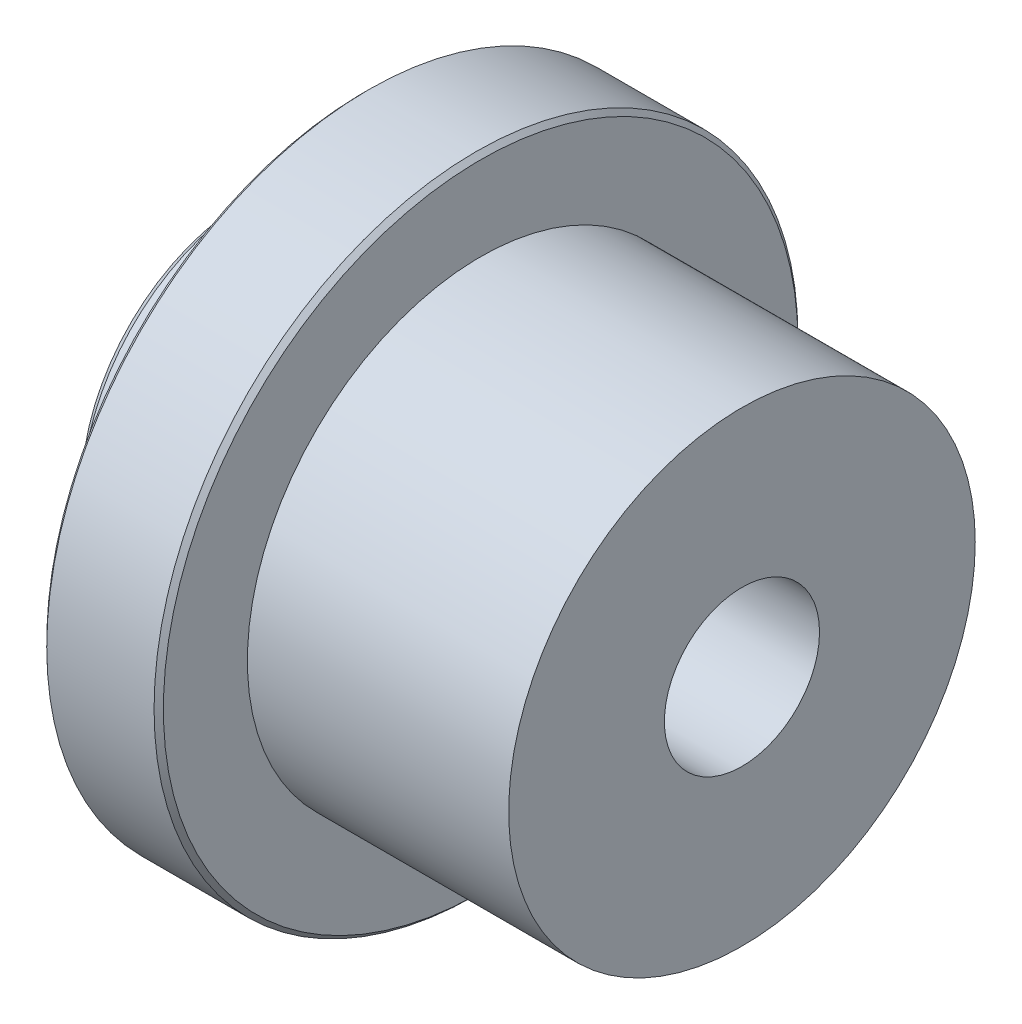
from build123d import *

# Parameters (mm, degrees)
SKETCH1_R           = 17.526
SKETCH1_R_2         = 3.96875
BOSS_EXTRUDE1_DEPTH = 6.35
CHAMFER2_SIZE       = 0.254
BOSS_EXTRUDE2_START = 6.35
SKETCH3_R           = 9.525
SKETCH3_R_2         = 3.96875
BOSS_EXTRUDE2_DEPTH = 6.35
CHAMFER3_SIZE       = 0.508
SKETCH8_R           = 12.7
SKETCH8_R_2         = 4.22275
BOSS_EXTRUDE3_DEPTH = 14.224
SKETCH6_R           = 1.9685
CUT_EXTRUDE2_DEPTH  = 16.764


with BuildPart() as part:
    # Sketch1 → Boss-Extrude1 (new body)
    with BuildSketch(Plane(origin=(0, 0, 0), x_dir=(0, 0, -1), z_dir=(1, 0, 0))):
        Circle(SKETCH1_R)
        Circle(SKETCH1_R_2, mode=Mode.SUBTRACT)
    extrude(amount=BOSS_EXTRUDE1_DEPTH)

    # Chamfer2
    chamfer2_edges = [part.edges().sort_by_distance(p)[0] for p in [
        (0, 0, 17.526),
        (6.35, 0, 17.526),
        (0, 0, 3.96875),
        (6.35, 0, 3.96875),
    ]]
    chamfer(chamfer2_edges, length=CHAMFER2_SIZE)

    # Sketch3 → Boss-Extrude2 (add)
    with BuildSketch(Plane.ZY.offset(BOSS_EXTRUDE2_START)):
        with Locations(Location((0, 0, 0), (0, 0, 180))):
            Circle(SKETCH3_R)
        with Locations(Location((0, 0, 0), (0, 0, 180))):
            Circle(SKETCH3_R_2, mode=Mode.SUBTRACT)
    extrude(amount=-BOSS_EXTRUDE2_DEPTH)

    # Chamfer3
    chamfer3_edges = [part.edges().sort_by_distance(p)[0] for p in [
        (0, 0, 9.525),
        (-6.35, 0, 9.525),
    ]]
    chamfer(chamfer3_edges, length=CHAMFER3_SIZE)

    # Sketch8 → Boss-Extrude3 (add)
    with BuildSketch(Plane(origin=(6.35, 0, 0), x_dir=(0, 0, -1), z_dir=(1, 0, 0))):
        Circle(SKETCH8_R)
        Circle(SKETCH8_R_2, mode=Mode.SUBTRACT)
    extrude(amount=BOSS_EXTRUDE3_DEPTH)

    # Sketch6 → Cut-Extrude2 (cut)
    with BuildSketch(Plane.XY):
        with Locations(Location((-3.175, 0, 0), (0, 0, 180))):
            Circle(SKETCH6_R)
        with Locations((13.462, 0)):
            Circle(SKETCH6_R)
    extrude(amount=-CUT_EXTRUDE2_DEPTH, mode=Mode.SUBTRACT)


solid = part.part
